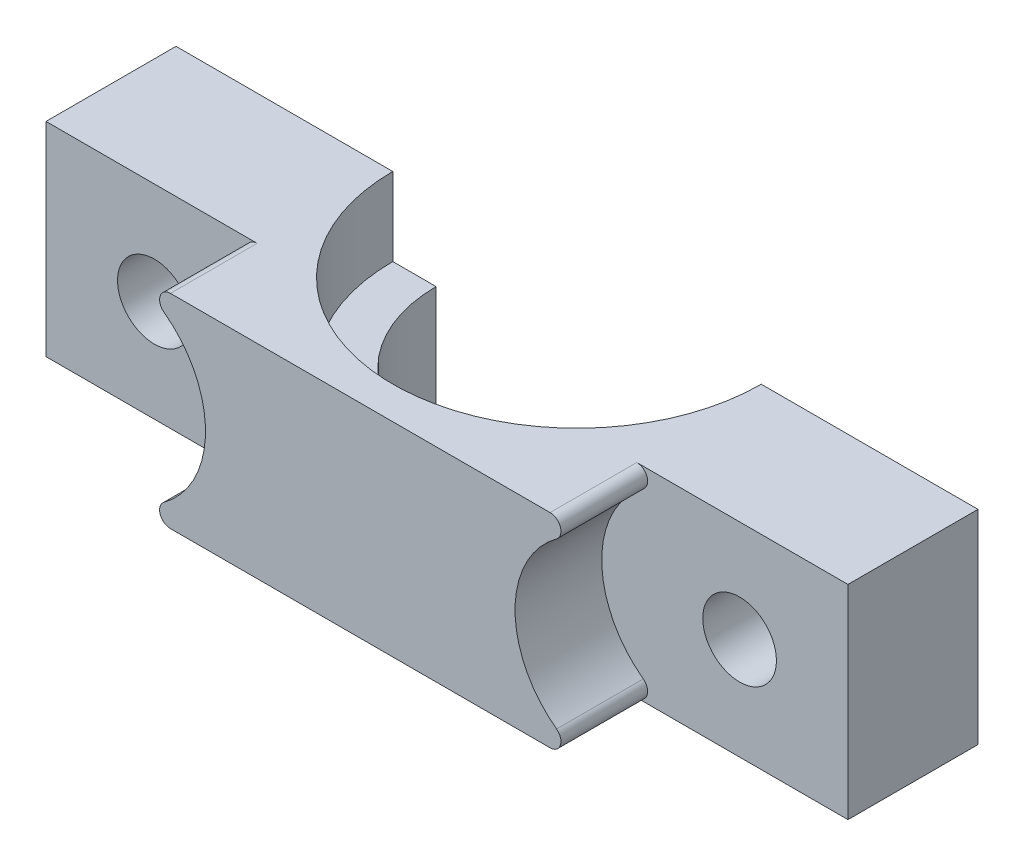
from build123d import *

# Parameters (mm, degrees)
BOSS_EXTRUDE1_DEPTH  = 5.8
BOSS_EXTRUDE2_DEPTH  = 3.6
M3_CLEARANCE_HOLE1_D = 3.4
CUT_EXTRUDE1_DEPTH   = 4
FILLET1_R            = 0.5


with BuildPart() as part:
    # Sketch1 → Boss-Extrude1 (new body)
    with BuildSketch(Plane(origin=(0, 0, 0), x_dir=(1, 0, 0), z_dir=(0, 1, 0))):
        with BuildLine():
            Line((-18.5, 0), (18.5, 0))
            Line((18.5, 0), (18.5, 10))
            Line((18.5, 10), (6.5, 10))
            ThreePointArc((6.5, 10), (0, 3.5), (-6.5, 10))
            Line((-6.5, 10), (-18.5, 10))
            Line((-18.5, 10), (-18.5, 0))
        make_face()
    extrude(amount=BOSS_EXTRUDE1_DEPTH)

    # Sketch7 → Boss-Extrude2 (add)
    with BuildSketch(Plane(origin=(0, 5.8, 0), x_dir=(1, 0, 0), z_dir=(0, 1, 0))):
        with BuildLine():
            Line((-18.5, 10), (-18.5, 0))
            Line((-18.5, 0), (18.5, 0))
            Line((18.5, 0), (18.5, 10))
            Line((18.5, 10), (8.5, 10))
            ThreePointArc((8.5, 10), (0, 1.5), (-8.5, 10))
            Line((-8.5, 10), (-18.5, 10))
        make_face()
    extrude(amount=BOSS_EXTRUDE2_DEPTH)

    # M3 Clearance Hole1 (through all)
    with Locations(Plane.XY):
        with Locations((-13.5, 4.7), (13.5, 4.7)):
            Hole(M3_CLEARANCE_HOLE1_D / 2)

    # Sketch5 → Cut-Extrude1 (cut)
    with BuildSketch(Plane.XY):
        with BuildLine():
            Line((-11.395542808, 9.4), (-18.5, 9.4))
            Line((-18.5, 9.4), (-18.5, 0))
            Line((-18.5, 0), (-11.395542808, 0))
            ThreePointArc((-11.395542808, 0), (-7.140159789, 4.7), (-11.395542808, 9.4))
        make_face()
        with BuildLine():
            Line((18.5, 0), (11.395542808, 0))
            ThreePointArc((11.395542808, 0), (7.140159789, 4.7), (11.395542808, 9.4))
            Line((11.395542808, 9.4), (18.5, 9.4))
            Line((18.5, 9.4), (18.5, 0))
        make_face()
    extrude(amount=-CUT_EXTRUDE1_DEPTH, mode=Mode.SUBTRACT)

    # Fillet1
    fillet1_edges = [part.edges().sort_by_distance(p)[0] for p in [
        (-11.395542808, 9.4, -2),
        (-11.395542808, 0, -2),
        (11.395542808, 0, -2),
        (11.395542808, 9.4, -2),
    ]]
    fillet(fillet1_edges, radius=FILLET1_R)


solid = part.part
